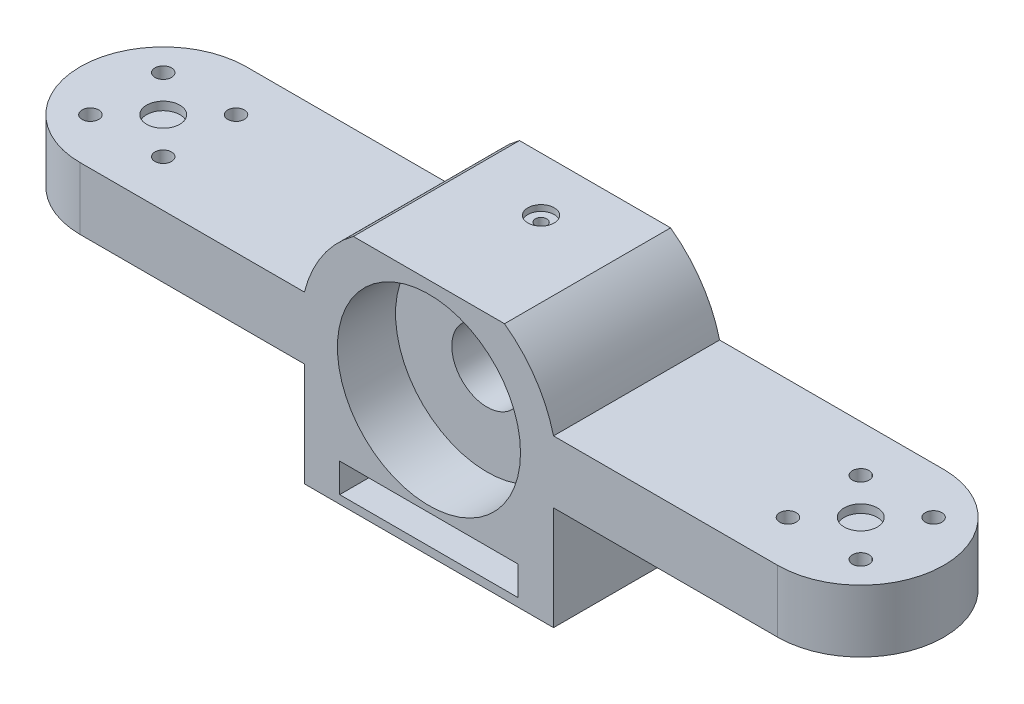
from build123d import *

# Parameters (mm, degrees)
BOSS_EXTRUDE1_DEPTH                                 = 25
SKETCH2_R                                           = 11.025
CUT_EXTRUDE1_DEPTH                                  = 7
CUT_EXTRUDE3_DEPTH                                  = 8.75
CUT_EXTRUDE5_DEPTH                                  = 8.75
SKETCH5_R                                           = 1
CUT_EXTRUDE6_DEPTH                                  = 7.5
SKETCH6_R                                           = 1.95
CUT_EXTRUDE7_DEPTH                                  = 6.5
SKETCH7_R                                           = 2
CUT_EXTRUDE8_DEPTH                                  = 1
CUT_EXTRUDE9_DEPTH                                  = 62.065538563
CUT_EXTRUDE10_REACH                                 = 61.144
SKETCH9_R                                           = 4.25
CBORE_FOR_00_BINDING_HEAD_MACHINE_SCREW_D           = 1.397
CBORE_FOR_00_BINDING_HEAD_MACHINE_SCREW_DEPTH       = 25
CBORE_FOR_00_BINDING_HEAD_MACHINE_SCREW_CBORE_D     = 3.175
CBORE_FOR_00_BINDING_HEAD_MACHINE_SCREW_CBORE_DEPTH = 0.7112
CBORE_FOR_00_BINDING_HEAD_MACHINE_SCREW_TIP         = 0.419701142
BOSS_EXTRUDE4_DEPTH                                 = 20
SKETCH20_W                                          = 21.5
SKETCH20_H                                          = 3.5
CUT_EXTRUDE13_DEPTH                                 = 16.5


with BuildPart() as part:
    # Sketch1 → Boss-Extrude1 (new body)
    with BuildSketch(Plane(origin=(0, 0, 0), x_dir=(1, 0, 0), z_dir=(0, 1, 0))):
        with BuildLine():
            Line((-42, -10), (42, -10))
            ThreePointArc((42, -10), (52, 0), (42, 10))
            Line((42, 10), (-42, 10))
            ThreePointArc((-42, 10), (-52, 0), (-42, -10))
        make_face()
    extrude(amount=BOSS_EXTRUDE1_DEPTH)

    # Sketch2 → Cut-Extrude1 (cut)
    with BuildSketch(Plane.XY.offset(10)):
        with Locations((0, 12.5)):
            Circle(SKETCH2_R)
    extrude(amount=-CUT_EXTRUDE1_DEPTH, mode=Mode.SUBTRACT)

    # Sketch3 → Cut-Extrude3 (cut)
    with BuildSketch(Plane.XZ):
        with BuildLine():
            Line((15, -10), (15, 10))
            Line((15, 10), (42, 10))
            ThreePointArc((42, 10), (52, 0), (42, -10))
            Line((42, -10), (15, -10))
        make_face()
        with BuildLine():
            Line((-15, -10), (-15, 10))
            Line((-15, 10), (-42, 10))
            ThreePointArc((-42, 10), (-52, 0), (-42, -10))
            Line((-42, -10), (-15, -10))
        make_face()
    extrude(amount=-CUT_EXTRUDE3_DEPTH, mode=Mode.SUBTRACT)

    # Sketch4 → Cut-Extrude5 (cut)
    with BuildSketch(Plane(origin=(0, 25, 0), x_dir=(1, 0, 0), z_dir=(0, 1, 0))):
        with BuildLine():
            Line((15, -10), (15, 10))
            Line((15, 10), (55, 10))
            ThreePointArc((55, 10), (65, 0), (55, -10))
            Line((55, -10), (15, -10))
        make_face()
        with BuildLine():
            Line((-15, -10), (-15, 10))
            Line((-15, 10), (-55, 10))
            ThreePointArc((-55, 10), (-65, 0), (-55, -10))
            Line((-55, -10), (-15, -10))
        make_face()
    extrude(amount=-CUT_EXTRUDE5_DEPTH, mode=Mode.SUBTRACT)

    # Sketch5 → Cut-Extrude6 (cut)
    with BuildSketch(Plane(origin=(0, 16.25, 0), x_dir=(1, 0, 0), z_dir=(0, 1, 0))):
        with Locations(Location((-46.384062043, 4.384062043, 0), (0, 0, 270))):
            Circle(SKETCH5_R)
        with Locations(Location((-37.615937957, 4.384062043, 0), (0, 0, 270))):
            Circle(SKETCH5_R)
        with Locations(Location((-37.615937957, -4.384062043, 0), (0, 0, 270))):
            Circle(SKETCH5_R)
        with Locations(Location((-46.384062043, -4.384062043, 0), (0, 0, 270))):
            Circle(SKETCH5_R)
        with Locations(Location((37.615937957, 4.384062043, 0), (0, 0, 270))):
            Circle(SKETCH5_R)
        with Locations(Location((46.384062043, 4.384062043, 0), (0, 0, 270))):
            Circle(SKETCH5_R)
        with Locations(Location((46.384062043, -4.384062043, 0), (0, 0, 270))):
            Circle(SKETCH5_R)
        with Locations(Location((37.615937957, -4.384062043, 0), (0, 0, 270))):
            Circle(SKETCH5_R)
    extrude(amount=-CUT_EXTRUDE6_DEPTH, mode=Mode.SUBTRACT)

    # Sketch6 → Cut-Extrude7 (cut)
    with BuildSketch(Plane.XZ.offset(-8.75)):
        with Locations(Location((-42, 6.2, 0), (0, 0, 270))):
            Circle(SKETCH6_R)
        with Locations(Location((-35.8, 0, 0), (0, 0, 270))):
            Circle(SKETCH6_R)
        with Locations(Location((-48.2, 0, 0), (0, 0, 270))):
            Circle(SKETCH6_R)
        with Locations(Location((-42, -6.2, 0), (0, 0, 270))):
            Circle(SKETCH6_R)
        with Locations(Location((42, 6.2, 0), (0, 0, 270))):
            Circle(SKETCH6_R)
        with Locations(Location((48.2, 0, 0), (0, 0, 270))):
            Circle(SKETCH6_R)
        with Locations(Location((35.8, 0, 0), (0, 0, 270))):
            Circle(SKETCH6_R)
        with Locations(Location((42, -6.2, 0), (0, 0, 270))):
            Circle(SKETCH6_R)
    extrude(amount=-CUT_EXTRUDE7_DEPTH, mode=Mode.SUBTRACT)

    # Sketch7 → Cut-Extrude8 (cut)
    with BuildSketch(Plane(origin=(0, 16.25, 0), x_dir=(1, 0, 0), z_dir=(0, 1, 0))):
        with Locations(Location((-42, 0, 0), (0, 0, 270))):
            Circle(SKETCH7_R)
        with Locations(Location((42, 0, 0), (0, 0, 270))):
            Circle(SKETCH7_R)
    extrude(amount=-CUT_EXTRUDE8_DEPTH, mode=Mode.SUBTRACT)

    # Sketch8 → Cut-Extrude9 (cut, through all)
    with BuildSketch(Plane.XY.offset(10)):
        with BuildLine():
            Line((-15, 16.25), (-15, 25))
            Line((-15, 25), (-9.100137362, 25))
            ThreePointArc((-9.100137362, 25), (-12.819702813, 21.143941218), (-15, 16.25))
        make_face()
        with BuildLine():
            Line((15, 0), (9.100137362, 0))
            ThreePointArc((9.100137362, 0), (12.819702813, 3.856058782), (15, 8.75))
            Line((15, 8.75), (15, 0))
        make_face()
        with BuildLine():
            Line((15, 25), (9.100137362, 25))
            ThreePointArc((9.100137362, 25), (12.819702813, 21.143941218), (15, 16.25))
            Line((15, 16.25), (15, 25))
        make_face()
        with BuildLine():
            Line((-15, 0), (-15, 8.75))
            ThreePointArc((-15, 8.75), (-12.819702813, 3.856058782), (-9.100137362, 0))
            Line((-9.100137362, 0), (-15, 0))
        make_face()
    extrude(amount=-CUT_EXTRUDE9_DEPTH, mode=Mode.SUBTRACT)

    # Sketch9 → Cut-Extrude10 (cut, up to next)
    with BuildSketch(Plane.XY.offset(3), mode=Mode.PRIVATE) as cut_extrude10_sk1:
        with Locations((0, 12.5)):
            Circle(SKETCH9_R)
    cut_extrude10_tool1 = extrude(cut_extrude10_sk1.sketch, amount=-CUT_EXTRUDE10_REACH, mode=Mode.PRIVATE) & part.part
    add(cut_extrude10_tool1.solids().sort_by_distance((0, 12.5, 3))[0], mode=Mode.SUBTRACT)

    # CBORE for #00 Binding Head Machine Screw2
    with Locations(Plane(origin=(0, 25, 0), x_dir=(1, 0, 0), z_dir=(0, 1, 0))):
        with Locations((0, 3.5)):
            CounterBoreHole(CBORE_FOR_00_BINDING_HEAD_MACHINE_SCREW_D / 2, CBORE_FOR_00_BINDING_HEAD_MACHINE_SCREW_CBORE_D / 2, CBORE_FOR_00_BINDING_HEAD_MACHINE_SCREW_CBORE_DEPTH, depth=CBORE_FOR_00_BINDING_HEAD_MACHINE_SCREW_DEPTH)
            with Locations((0, 0, -(CBORE_FOR_00_BINDING_HEAD_MACHINE_SCREW_DEPTH + CBORE_FOR_00_BINDING_HEAD_MACHINE_SCREW_TIP / 2))):  # 118° drill point
                Cone(0, CBORE_FOR_00_BINDING_HEAD_MACHINE_SCREW_D / 2, CBORE_FOR_00_BINDING_HEAD_MACHINE_SCREW_TIP, mode=Mode.SUBTRACT)

    # Sketch19 → Boss-Extrude4 (add, through all)
    with BuildSketch(Plane(origin=(0, 0, -10), x_dir=(-1, 0, 0), z_dir=(0, 0, -1))):
        with BuildLine():
            Line((-9.100137362, 0), (9.100137362, 0))
            ThreePointArc((9.100137362, 0), (12.819702813, 3.856058782), (15, 8.75))
            Line((15, 8.75), (15, -3.75))
            Line((15, -3.75), (-15, -3.75))
            Line((-15, -3.75), (-15, 8.75))
            ThreePointArc((-15, 8.75), (-12.819702813, 3.856058782), (-9.100137362, 0))
        make_face()
    extrude(amount=-BOSS_EXTRUDE4_DEPTH)

    # Sketch20 → Cut-Extrude13 (cut)
    with BuildSketch(Plane.XY.offset(10)):
        with Locations((0, -1)):
            Rectangle(SKETCH20_W, SKETCH20_H)
    extrude(amount=-CUT_EXTRUDE13_DEPTH, mode=Mode.SUBTRACT)


solid = part.part
